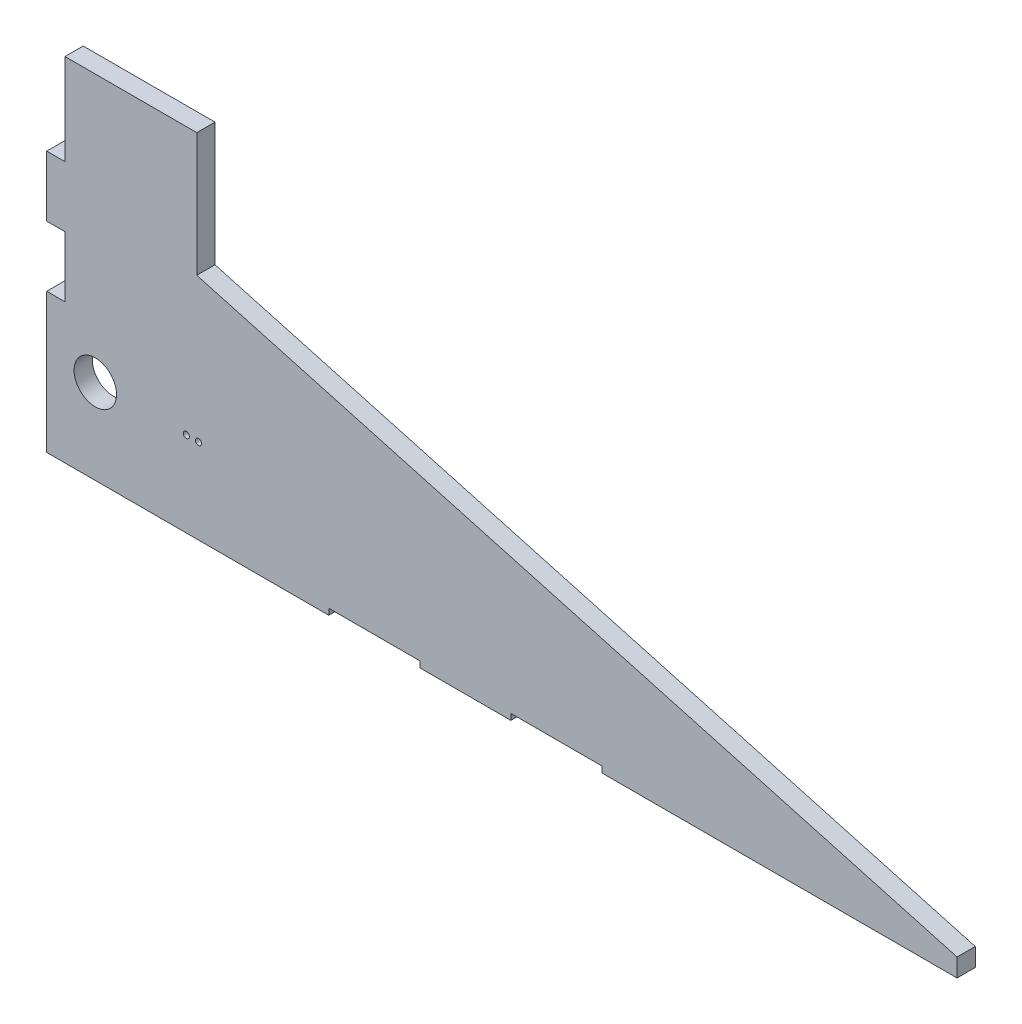
from build123d import *

# Parameters (mm, degrees)
EXTRUDE_1_DEPTH      = 0.5
EXTRUDE_2_DEPTH      = 109.5
SKETCH_8_W           = 60
SKETCH_8_H           = 8
SKETCH_8_W_2         = 60.000005443
CUT_EXTRUDE_2_DEPTH  = 10
CUT_EXTRUDE_3_DEPTH  = 10
EXTRUDE_4_DEPTH      = 2.5
FILLET_3_R           = 0.25
FILLET_4_R           = 0.25
SKETCH_7_R           = 3.5
SKETCH_7_R_2         = 0.5
CUT_EXTRUDE_4_DEPTH  = 244
SKETCH_11_W          = 306.812384231
SKETCH_11_H          = 135.84704279
CUT_EXTRUDE_6_DEPTH  = 266
SKETCH_15_W          = 3
SKETCH_15_H          = 15
SKETCH_15_H_2        = 10
CUT_EXTRUDE_9_DEPTH  = 3
SKETCH_16_W          = 15
SKETCH_16_H          = 3
CUT_EXTRUDE_10_DEPTH = 1


with BuildPart() as part:
    # 草图1 → 凸台-拉伸1 (new body)
    with BuildSketch(Plane.XY):
        Polygon((0, -1.078212291), (0, -59.078212291), (150, -59.078212291), (150, -56.078212291), (24.720670391, -21.433997855), (24.720670391, -1.078212291), align=None)
    extrude(amount=EXTRUDE_1_DEPTH)

    # 草图2 → 凸台-拉伸2 (add)
    with BuildSketch(Plane(origin=(0, 0, 0), x_dir=(-1, 0, 0), z_dir=(0, 0, -1))):
        with BuildLine():
            Line((0, -1.078212291), (-2.47, -1.078212291))
            Line((-2.47, -1.078212291), (-2.47, -54.078212291))
            Line((-2.47, -54.078212291), (-149.757622023, -58.570819212))
            ThreePointArc((-149.757622023, -58.570819212), (-149.929451255, -58.64664195), (-150, -58.820702994))
            Line((-150, -58.820702994), (-150, -58.828212291))
            ThreePointArc((-150, -58.828212291), (-149.926776695, -59.004988986), (-149.75, -59.078212291))
            Line((-149.75, -59.078212291), (0, -59.078212291))
            Line((0, -59.078212291), (0, -1.078212291))
        make_face()
    extrude(amount=EXTRUDE_2_DEPTH)

    # 镜向3: part across plane


with BuildPart() as part_1:
    add(part.part)
    add(part.part.mirror(Plane(origin=(149.75, -58.820702994, -109.5), x_dir=(1, 0, 0), z_dir=(0, 0, 1))))

    # 草图8 → 切除-拉伸2 (cut)
    with BuildSketch(Plane(origin=(-1.645679091, -53.952674733, 0), x_dir=(0.9995351300973986, -0.030488091136977483, 0), z_dir=(0.030488091136977483, 0.9995351300973986, 0))):
        with Locations((121.473716686, 5)):
            Rectangle(SKETCH_8_W, SKETCH_8_H)
        with Locations((121.473713965, 15)):
            Rectangle(SKETCH_8_W_2, SKETCH_8_H)
        with Locations((121.473713965, 24.947368421)):
            Rectangle(SKETCH_8_W_2, SKETCH_8_H)
        with Locations((121.473713965, 34.894736842)):
            Rectangle(SKETCH_8_W_2, SKETCH_8_H)
        with Locations((121.473713965, 44.842105263)):
            Rectangle(SKETCH_8_W_2, SKETCH_8_H)
        with Locations((121.473713965, 54.789473684)):
            Rectangle(SKETCH_8_W_2, SKETCH_8_H)
        with Locations((121.473713965, 64.736842105)):
            Rectangle(SKETCH_8_W_2, SKETCH_8_H)
        with Locations((121.473713965, 74.684210526)):
            Rectangle(SKETCH_8_W_2, SKETCH_8_H)
        with Locations((121.473713965, 84.631578947)):
            Rectangle(SKETCH_8_W_2, SKETCH_8_H)
        with Locations((121.473713965, 94.578947368)):
            Rectangle(SKETCH_8_W_2, SKETCH_8_H)
        with Locations((121.473713965, 104.526315789)):
            Rectangle(SKETCH_8_W_2, SKETCH_8_H)
        with Locations((121.473713965, 114.473684211)):
            Rectangle(SKETCH_8_W_2, SKETCH_8_H)
        with Locations((121.473713965, 124.421052632)):
            Rectangle(SKETCH_8_W_2, SKETCH_8_H)
        with Locations((121.473713965, 134.368421053)):
            Rectangle(SKETCH_8_W_2, SKETCH_8_H)
        with Locations((121.473713965, 144.315789474)):
            Rectangle(SKETCH_8_W_2, SKETCH_8_H)
        with Locations((121.473713965, 154.263157895)):
            Rectangle(SKETCH_8_W_2, SKETCH_8_H)
        with Locations((121.473713965, 164.210526316)):
            Rectangle(SKETCH_8_W_2, SKETCH_8_H)
        with Locations((121.473713965, 174.157894737)):
            Rectangle(SKETCH_8_W_2, SKETCH_8_H)
        with Locations((121.473713965, 184.105263158)):
            Rectangle(SKETCH_8_W_2, SKETCH_8_H)
        with Locations((121.473713965, 194.052631579)):
            Rectangle(SKETCH_8_W_2, SKETCH_8_H)
        with Locations((121.473713965, 204)):
            Rectangle(SKETCH_8_W_2, SKETCH_8_H)
        with Locations((121.473716686, 214)):
            Rectangle(SKETCH_8_W, SKETCH_8_H)
    extrude(amount=-CUT_EXTRUDE_2_DEPTH, mode=Mode.SUBTRACT)

    # 草图9 → 切除-拉伸3 (cut)
    with BuildSketch(Plane(origin=(-1.645679091, -53.952674733, 0), x_dir=(0.9995351300973986, -0.030488091136977483, 0), z_dir=(0.030488091136977483, 0.9995351300973986, 0))):
        Polygon((151.639987162, 219), (153.085665737, 219), (154.855962757, 1), (151.716207414, 1), (151.473716686, 1), (151.473716686, 219), align=None)
    extrude(amount=-CUT_EXTRUDE_3_DEPTH, mode=Mode.SUBTRACT)

    # 草图1<3> → 凸台-拉伸4 (add)
    with BuildSketch(Plane.XY):
        Polygon((0, -1.078212291), (0, -59.078212291), (150, -59.078212291), (150, -56.078212291), (24.720670391, -21.433997855), (24.720670391, -1.078212291), align=None)
    extrude_4 = extrude(amount=-EXTRUDE_4_DEPTH)

    # 圆角3
    fillet_3_edges = [part_1.edges().sort_by_distance(p)[0] for p in [
        (149.757622023, -58.570819212, -179.131578947),
        (149.757622023, -58.570819212, -189.078947368),
        (149.757622023, -58.570819212, -199.026315789),
        (149.757622023, -58.570819212, -209),
        (149.757622023, -58.570819212, -218.5),
        (149.757622023, -58.570819212, -89.605263158),
        (149.757622023, -58.570819212, -99.552631579),
        (149.757622023, -58.570819212, -109.5),
        (149.757622023, -58.570819212, -119.447368421),
        (149.757622023, -58.570819212, -129.394736842),
        (149.757622023, -58.570819212, -139.342105263),
        (149.757622023, -58.570819212, -149.289473684),
        (149.757622023, -58.570819212, -159.236842105),
        (149.757622023, -58.570819212, -169.184210526),
        (149.757622023, -58.570819212, -79.657894737),
        (149.757622023, -58.570819212, -69.710526316),
        (149.757622023, -58.570819212, -59.763157895),
        (149.757622023, -58.570819212, -49.815789474),
        (149.757622023, -58.570819212, -39.868421053),
        (149.757622023, -58.570819212, -29.921052632),
        (149.757622023, -58.570819212, -19.973684211),
        (149.757622023, -58.570819212, -10),
    ]]
    fillet(fillet_3_edges, radius=FILLET_3_R)

    # 圆角4
    fillet_4_edges = [part_1.edges().sort_by_distance(p)[0] for p in [
        (149.742145382, -59.078212291, -49.815789474),
        (149.742145382, -59.078212291, -39.868421053),
        (149.742145382, -59.078212291, -29.921052632),
        (149.742145382, -59.078212291, -19.973684211),
        (149.742145382, -59.078212291, -10),
        (149.742145382, -59.078212291, -69.710526316),
        (149.742145382, -59.078212291, -59.763157895),
        (149.742145382, -59.078212291, -89.605263158),
        (149.742145382, -59.078212291, -79.657894737),
        (149.742145382, -59.078212291, -129.394736842),
        (149.742145382, -59.078212291, -119.447368421),
        (149.742145382, -59.078212291, -109.5),
        (149.742145382, -59.078212291, -99.552631579),
        (149.742145382, -59.078212291, -139.342105263),
        (149.742145382, -59.078212291, -149.289473684),
        (149.742145382, -59.078212291, -159.236842105),
        (149.742145382, -59.078212291, -169.184210526),
        (149.742145382, -59.078212291, -218.5),
        (149.742145382, -59.078212291, -209),
        (149.742145382, -59.078212291, -199.026315789),
        (149.742145382, -59.078212291, -189.078947368),
        (149.742145382, -59.078212291, -179.131578947),
    ]]
    fillet(fillet_4_edges, radius=FILLET_4_R)

    # 镜向4: 凸台-拉伸4 across plane
    add(extrude_4.mirror(Plane.XY.offset(-109.5)))

    # 草图7 → 切除-拉伸4 (cut)
    with BuildSketch(Plane.XY.offset(0.5)):
        with Locations((8, -45.078212291)):
            Circle(SKETCH_7_R)
        with Locations((25, -45.078212291)):
            Circle(SKETCH_7_R_2)
        with Locations((23, -45.078212291)):
            Circle(SKETCH_7_R_2)
    extrude(amount=-CUT_EXTRUDE_4_DEPTH, mode=Mode.SUBTRACT)

    # 草图11 → 切除-拉伸6 (cut)
    with BuildSketch(Plane(origin=(150, 0, 0), x_dir=(0, 0, -1), z_dir=(1, 0, 0))):
        with Locations((155.906192116, 8.845309104)):
            Rectangle(SKETCH_11_W, SKETCH_11_H)
    extrude(amount=-CUT_EXTRUDE_6_DEPTH, mode=Mode.SUBTRACT)

    # 草图15 → 切除-拉伸9 (cut)
    with BuildSketch(Plane.ZY):
        with Locations((-1, -8.578212291)):
            Rectangle(SKETCH_15_W, SKETCH_15_H)
        with Locations((-1, -31.078212291)):
            Rectangle(SKETCH_15_W, SKETCH_15_H_2)
    extrude(amount=-CUT_EXTRUDE_9_DEPTH, mode=Mode.SUBTRACT)

    # 草图16 → 切除-拉伸10 (cut)
    with BuildSketch(Plane(origin=(0, -59.078212291, 0), x_dir=(-1, 0, 0), z_dir=(0, -1, 0))):
        with Locations((-83.973716686, 1)):
            Rectangle(SKETCH_16_W, SKETCH_16_H)
        with Locations((-53.973716686, 1)):
            Rectangle(SKETCH_16_W, SKETCH_16_H)
    extrude(amount=-CUT_EXTRUDE_10_DEPTH, mode=Mode.SUBTRACT)


solid = part_1.part
